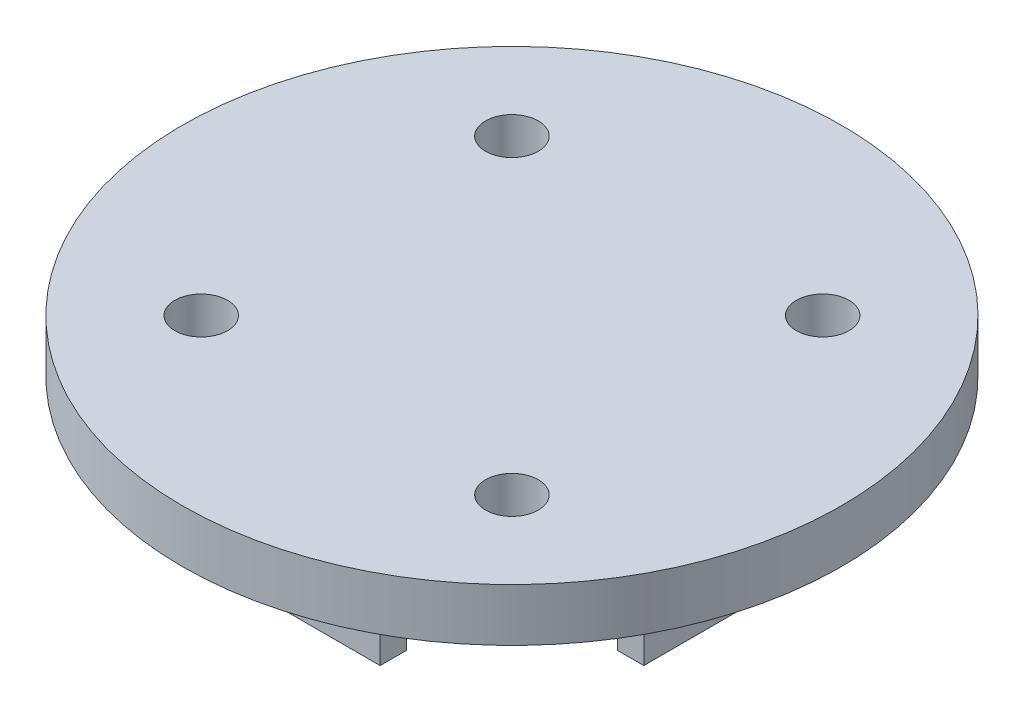
from build123d import *

# Parameters (mm, degrees)
SKETCH_1_R               = 37.5
EXTRUDE_1_DEPTH          = 6
SKETCH_4_R               = 3
CUT_EXTRUDE_2_DEPTH      = 54.371340624
PATTERN_CIRCULAR_1_COUNT = 4
SKETCH_5_W               = 18
SKETCH_5_H               = 3
EXTRUDE_2_DEPTH          = 12
SKETCH_5_3_W             = 18
SKETCH_5_3_H             = 3
SKETCH_5_3_W_2           = 3
SKETCH_5_3_H_2           = 18
EXTRUDE_3_DEPTH          = 12
SKETCH_6_R               = 2.1
CUT_EXTRUDE_3_DEPTH      = 74.023968668
SKETCH_7_R               = 2.1
CUT_EXTRUDE_4_DEPTH      = 74.023968668


with BuildPart() as part:
    # 草图1 → 凸台-拉伸1 (new body)
    with BuildSketch(Plane(origin=(0, 0, 0), x_dir=(1, 0, 0), z_dir=(0, 1, 0))):
        Circle(SKETCH_1_R)
    extrude(amount=EXTRUDE_1_DEPTH)

    # 草图4 → 切除-拉伸2 (cut, through all)
    with BuildSketch(Plane(origin=(0, 0, 0), x_dir=(1, 0, 0), z_dir=(0, 1, 0))):
        with Locations((-17.67766953, 17.67766953)):
            Circle(SKETCH_4_R)
    cut_extrude_2 = extrude(amount=CUT_EXTRUDE_2_DEPTH, mode=Mode.SUBTRACT)

    # 阵列(圆周)1: 切除-拉伸2 ×4 about axis
    pattern_circular_1_axis = Axis((0, 0, 0), (0, -1, 0))
    for i in range(1, PATTERN_CIRCULAR_1_COUNT):
        add(cut_extrude_2.rotate(pattern_circular_1_axis, i * 360 / PATTERN_CIRCULAR_1_COUNT), mode=Mode.SUBTRACT)

    # 草图5 → 凸台-拉伸2 (add)
    with BuildSketch(Plane(origin=(0, 0, 0), x_dir=(-1, 0, 0), z_dir=(0, -1, 0))):
        with Locations((0, 22.5)):
            Rectangle(SKETCH_5_W, SKETCH_5_H)
    extrude_2 = extrude(amount=EXTRUDE_2_DEPTH)

    # 草图5<3> → 凸台-拉伸3 (add)
    with BuildSketch(Plane(origin=(0, 0, 0), x_dir=(-1, 0, 0), z_dir=(0, -1, 0))):
        with Locations((0, 22.5)):
            Rectangle(SKETCH_5_3_W, SKETCH_5_3_H)
        with Locations((22.5, 0)):
            Rectangle(SKETCH_5_3_W_2, SKETCH_5_3_H_2)
    extrude_3 = extrude(amount=EXTRUDE_3_DEPTH)

    # 镜向3: 凸台-拉伸2 across plane
    add(extrude_2.mirror(Plane.XY))

    # 镜向4: 凸台-拉伸3 across plane
    add(extrude_3.mirror(Plane(origin=(0, 0, 0), x_dir=(0, 0, 1), z_dir=(1, 0, 0))))

    # 草图6 → 切除-拉伸3 (cut, through all)
    with BuildSketch(Plane.XY.offset(24)):
        with Locations((0, -6)):
            Circle(SKETCH_6_R)
    extrude(amount=-CUT_EXTRUDE_3_DEPTH, mode=Mode.SUBTRACT)

    # 草图7 → 切除-拉伸4 (cut, through all)
    with BuildSketch(Plane(origin=(24, 0, 0), x_dir=(0, 0, -1), z_dir=(1, 0, 0))):
        with Locations((0, -6)):
            Circle(SKETCH_7_R)
    extrude(amount=-CUT_EXTRUDE_4_DEPTH, mode=Mode.SUBTRACT)


solid = part.part
